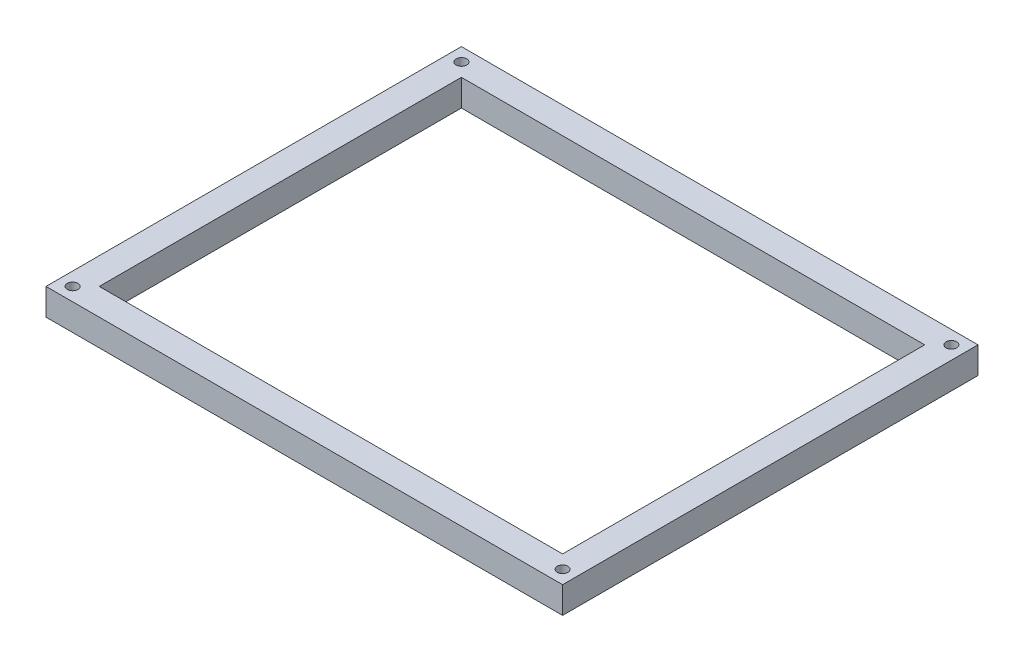
from build123d import *

# Parameters (mm, degrees)
SKETCH1_W           = 194
SKETCH1_H           = 156
SKETCH1_W_2         = 174
SKETCH1_H_2         = 136
BOSS_EXTRUDE1_DEPTH = 10
SKETCH2_R           = 2
CUT_EXTRUDE1_DEPTH  = 10


with BuildPart() as part:
    # Sketch1 → Boss-Extrude1 (new body)
    with BuildSketch(Plane(origin=(0, 0, 0), x_dir=(1, 0, 0), z_dir=(0, 1, 0))):
        Rectangle(SKETCH1_W, SKETCH1_H)
        Rectangle(SKETCH1_W_2, SKETCH1_H_2, mode=Mode.SUBTRACT)
    extrude(amount=BOSS_EXTRUDE1_DEPTH)

    # Sketch2 → Cut-Extrude1 (cut)
    with BuildSketch(Plane(origin=(0, 10, 0), x_dir=(1, 0, 0), z_dir=(0, 1, 0))):
        with Locations(Location((-92, 73, 0), (0, 0, 270))):
            Circle(SKETCH2_R)
        with Locations(Location((-92, -73, 0), (0, 0, 270))):
            Circle(SKETCH2_R)
        with Locations(Location((92, -73, 0), (0, 0, 270))):
            Circle(SKETCH2_R)
        with Locations(Location((92, 73, 0), (0, 0, 270))):
            Circle(SKETCH2_R)
    extrude(amount=-CUT_EXTRUDE1_DEPTH, mode=Mode.SUBTRACT)


solid = part.part
